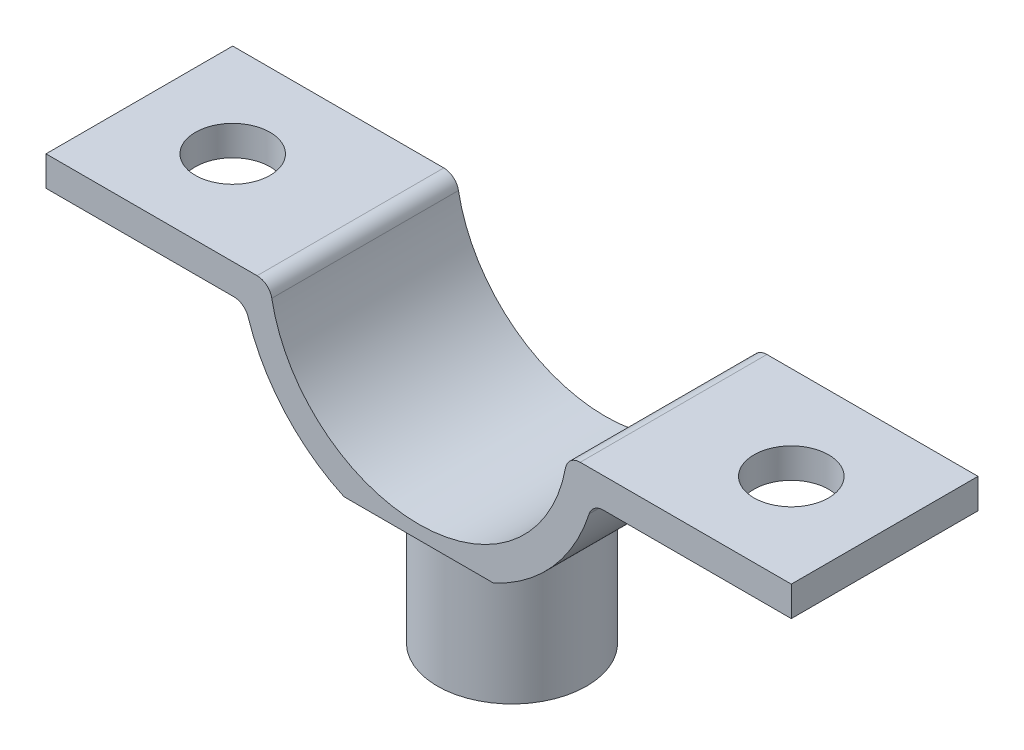
from build123d import *

# Parameters (mm, degrees)
BOSS_EXTRUDE1_DEPTH = 12.5
SKETCH4_OUTSIDE_W   = 62.868
SKETCH4_OUTSIDE_H   = 25.468
SKETCH4_OUTSIDE_R   = 5
CUT_EXTRUDE6_DEPTH  = 9.11
SKETCH5_R           = 3
CUT_EXTRUDE7_DEPTH  = 9.11
CUT_EXTRUDE8_REACH  = 35.77
SKETCH6_R           = 2.5


with BuildPart() as part:
    # Sketch1 → Boss-Extrude1 (new body)
    with BuildSketch(Plane.XY):
        with BuildLine():
            Line((-10.816653826, 19.01731952), (-19.949874371, 19.01731952))
            Line((-19.949874371, 19.01731952), (-24.949874371, 19.01731952))
            Line((-24.949874371, 19.01731952), (-24.949874371, 17.01731952))
            Line((-24.949874371, 17.01731952), (-19.949874371, 17.01731952))
            Line((-19.949874371, 17.01731952), (-12.369316877, 17.01731952))
            ThreePointArc((-12.369316877, 17.01731952), (-11.780968471, 16.82592706), (-11.417830963, 16.325011828))
            ThreePointArc((-11.417830963, 16.325011828), (-8.966906745, 12.042698311), (-5, 9.108607405))
            Line((-5, 9.108607405), (-5, 0))
            Line((-5, 0), (5, 0))
            Line((5, 0), (5, 9.108607405))
            ThreePointArc((5, 9.108607405), (8.966906745, 12.042698311), (11.417830963, 16.325011828))
            ThreePointArc((11.417830963, 16.325011828), (11.780968471, 16.82592706), (12.369316877, 17.01731952))
            Line((12.369316877, 17.01731952), (19.949874371, 17.01731952))
            Line((19.949874371, 17.01731952), (24.949874371, 17.01731952))
            Line((24.949874371, 17.01731952), (24.949874371, 19.01731952))
            Line((24.949874371, 19.01731952), (19.949874371, 19.01731952))
            Line((19.949874371, 19.01731952), (10.816653826, 19.01731952))
            ThreePointArc((10.816653826, 19.01731952), (10.177051677, 18.786025635), (9.83332166, 18.199137702))
            ThreePointArc((9.83332166, 18.199137702), (0, 10.01731952), (-9.83332166, 18.199137702))
            ThreePointArc((-9.83332166, 18.199137702), (-10.177051677, 18.786025635), (-10.816653826, 19.01731952))
        make_face()
    extrude(amount=BOSS_EXTRUDE1_DEPTH)

    # Sketch4 outside → Cut-Extrude6 (cut)
    with BuildSketch(Plane.XZ):
        with Locations((0, 6.25)):
            Rectangle(SKETCH4_OUTSIDE_W, SKETCH4_OUTSIDE_H)
        with Locations((0, 6.25)):
            Circle(SKETCH4_OUTSIDE_R, mode=Mode.SUBTRACT)
    extrude(amount=-CUT_EXTRUDE6_DEPTH, mode=Mode.SUBTRACT)

    # Sketch5 → Cut-Extrude7 (cut)
    with BuildSketch(Plane.XZ):
        with Locations((0, 6.25)):
            Circle(SKETCH5_R)
    extrude(amount=-CUT_EXTRUDE7_DEPTH, mode=Mode.SUBTRACT)

    # Sketch6 → Cut-Extrude8 (cut, up to next)
    with BuildSketch(Plane(origin=(0, 19.01731952, 0), x_dir=(1, 0, 0), z_dir=(0, 1, 0)), mode=Mode.PRIVATE) as cut_extrude8_sk1:
        with Locations(Location((-18.699874371, -6.25, 0), (0, 0, 180))):
            Circle(SKETCH6_R)
    cut_extrude8_tool1 = extrude(cut_extrude8_sk1.sketch, amount=-CUT_EXTRUDE8_REACH, mode=Mode.PRIVATE) & part.part
    # Sketch6 → Cut-Extrude8 (cut, up to next)
    with BuildSketch(Plane(origin=(0, 19.01731952, 0), x_dir=(1, 0, 0), z_dir=(0, 1, 0)), mode=Mode.PRIVATE) as cut_extrude8_sk2:
        with Locations(Location((18.699874371, -6.25, 0), (0, 0, 270))):
            Circle(SKETCH6_R)
    cut_extrude8_tool2 = extrude(cut_extrude8_sk2.sketch, amount=-CUT_EXTRUDE8_REACH, mode=Mode.PRIVATE) & part.part
    add(cut_extrude8_tool1.solids().sort_by_distance((-18.699874, 19.01732, 6.25))[0], mode=Mode.SUBTRACT)
    add(cut_extrude8_tool2.solids().sort_by_distance((18.699874, 19.01732, 6.25))[0], mode=Mode.SUBTRACT)


solid = part.part
